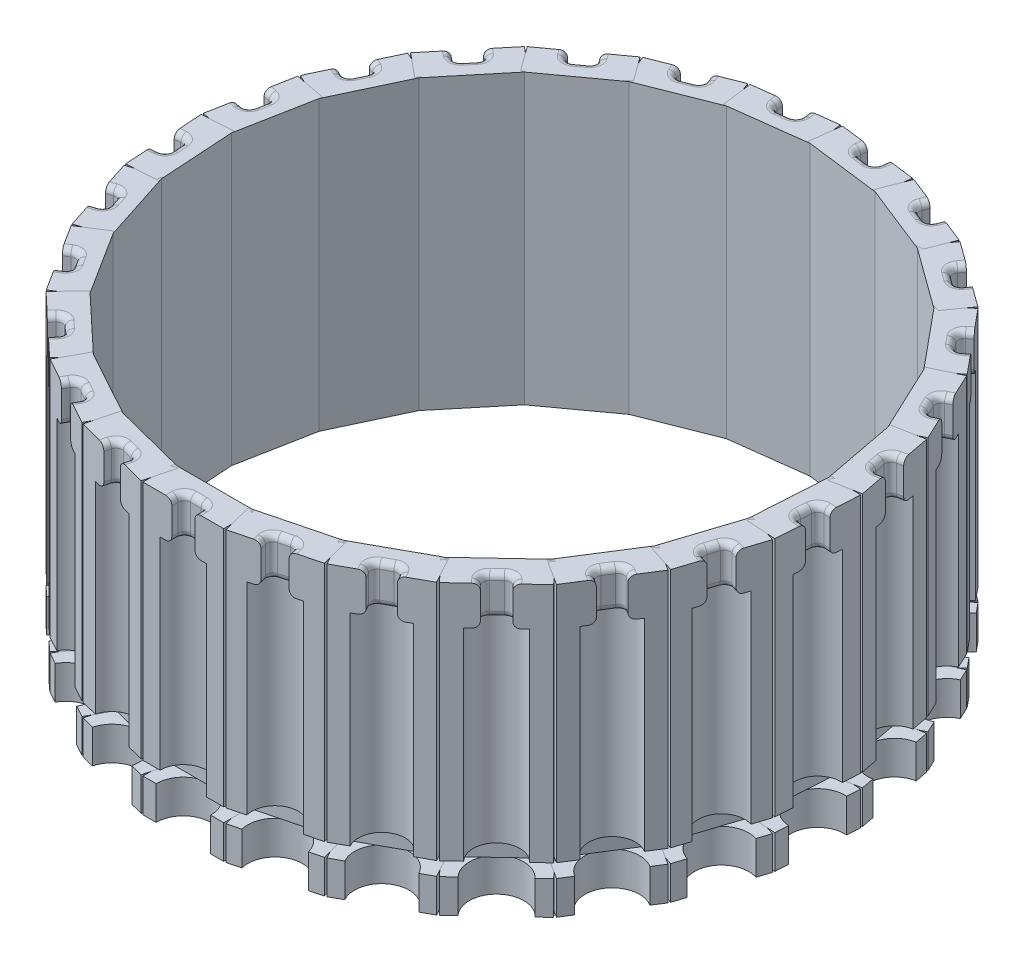
from build123d import *

# Parameters (mm, degrees)
SKETCH1_W           = 150
SKETCH1_H           = 300
BOSS_EXTRUDE1_DEPTH = 10
FLANGE_SLIT_W       = 26
FLANGE_SLIT_H       = 4.4
FLANGE_SLOT_DEPTH   = 8
SKETCH3_W           = 7.5
SKETCH3_H           = 65
SKETCH6_W           = 57.250839866
SKETCH6_H           = 300
CUT_EXTRUDE2_DEPTH  = 169.002976164
SKETCH7_W           = 8.778199967
SKETCH7_H           = 10.8
SKETCH8_W           = 7.4
SKETCH8_H           = 25.098320268
NEEDLE_SLOT_DEPTH   = 4
FILLET1_R           = 2
SKETCH11_W          = 274
SKETCH11_H          = 92.749160134
CUT_EXTRUDE3_DEPTH  = 169.002976164
CIRPATTERN2_COUNT   = 25


with BuildPart() as part:
    # Sketch1 → Boss-Extrude1 (new body)
    with BuildSketch(Plane(origin=(0, 0, 0), x_dir=(0, 1, 0), z_dir=(0, 0, 1))):
        Rectangle(SKETCH1_W, SKETCH1_H)
    extrude(amount=BOSS_EXTRUDE1_DEPTH)

    # flange slit → Flange Slot (cut)
    with BuildSketch(Plane.XY.offset(10)):
        with Locations((-137, -62)):
            Rectangle(FLANGE_SLIT_W, FLANGE_SLIT_H)
    extrude(amount=-FLANGE_SLOT_DEPTH, mode=Mode.SUBTRACT)

    # Sketch3 → Syringe Body Slot (revolve, cut)
    with BuildSketch(Plane.XY.offset(10)):
        with Locations((-140.75, -27.3)):
            Rectangle(SKETCH3_W, SKETCH3_H)
    revolve(axis=Axis((-137, 75, 10), (0, -1, 0)), mode=Mode.SUBTRACT)

    # Sketch6 → Cut-Extrude2 (cut, through all)
    with BuildSketch(Plane(origin=(0, 0, 10), x_dir=(0, -1, 0), z_dir=(0, 0, 1))):
        with Locations((-46.374580067, 0)):
            Rectangle(SKETCH6_W, SKETCH6_H)
    extrude(amount=-CUT_EXTRUDE2_DEPTH, mode=Mode.SUBTRACT)

    # Sketch7 → Plunger Slot (revolve, cut)
    with BuildSketch(Plane.XY.offset(10)):
        with Locations((-141.389099983, -69.6)):
            Rectangle(SKETCH7_W, SKETCH7_H)
    revolve(axis=Axis((-137, -64.2, 10), (0, -1, 0)), mode=Mode.SUBTRACT)

    # Sketch8 → Needle Slot (cut)
    with BuildSketch(Plane.XY.offset(10)):
        with Locations((-137, 5.2)):
            Rectangle(SKETCH8_W, SKETCH8_H)
    extrude(amount=-NEEDLE_SLOT_DEPTH, mode=Mode.SUBTRACT)

    # Fillet1
    fillet1_edges = [part.edges().sort_by_distance(p)[0] for p in [
        (-140.7, 17.749160134, 8),
        (-140.7, 5.2, 8),
        (-133.3, 17.749160134, 8),
        (-133.3, 5.2, 8),
        (-140.7, 11.474580067, 6),
        (-137, 17.749160134, 6),
        (-133.3, 11.474580067, 6),
        (-137, 5.2, 6),
    ]]
    fillet(fillet1_edges, radius=FILLET1_R)

    # Sketch11 → Cut-Extrude3 (cut, through all)
    with BuildSketch(Plane.XY.offset(10)):
        with Locations((13, -28.625419933)):
            Rectangle(SKETCH11_W, SKETCH11_H)
    extrude(amount=-CUT_EXTRUDE3_DEPTH, mode=Mode.SUBTRACT)


with BuildPart() as cirpattern2_1:
    # CirPattern2: pattern copy
    add(part.part.rotate(Axis((-137, -78.679881464, -95.483786158), (0, 1, 0)), 1 * 360 / CIRPATTERN2_COUNT))


with BuildPart() as cirpattern2_2:
    # CirPattern2: pattern copy
    add(part.part.rotate(Axis((-137, -78.679881464, -95.483786158), (0, 1, 0)), 2 * 360 / CIRPATTERN2_COUNT))


with BuildPart() as cirpattern2_3:
    # CirPattern2: pattern copy
    add(part.part.rotate(Axis((-137, -78.679881464, -95.483786158), (0, 1, 0)), 3 * 360 / CIRPATTERN2_COUNT))


with BuildPart() as cirpattern2_4:
    # CirPattern2: pattern copy
    add(part.part.rotate(Axis((-137, -78.679881464, -95.483786158), (0, 1, 0)), 4 * 360 / CIRPATTERN2_COUNT))


with BuildPart() as cirpattern2_5:
    # CirPattern2: pattern copy
    add(part.part.rotate(Axis((-137, -78.679881464, -95.483786158), (0, 1, 0)), 5 * 360 / CIRPATTERN2_COUNT))


with BuildPart() as cirpattern2_6:
    # CirPattern2: pattern copy
    add(part.part.rotate(Axis((-137, -78.679881464, -95.483786158), (0, 1, 0)), 6 * 360 / CIRPATTERN2_COUNT))


with BuildPart() as cirpattern2_7:
    # CirPattern2: pattern copy
    add(part.part.rotate(Axis((-137, -78.679881464, -95.483786158), (0, 1, 0)), 7 * 360 / CIRPATTERN2_COUNT))


with BuildPart() as cirpattern2_8:
    # CirPattern2: pattern copy
    add(part.part.rotate(Axis((-137, -78.679881464, -95.483786158), (0, 1, 0)), 8 * 360 / CIRPATTERN2_COUNT))


with BuildPart() as cirpattern2_9:
    # CirPattern2: pattern copy
    add(part.part.rotate(Axis((-137, -78.679881464, -95.483786158), (0, 1, 0)), 9 * 360 / CIRPATTERN2_COUNT))


with BuildPart() as cirpattern2_10:
    # CirPattern2: pattern copy
    add(part.part.rotate(Axis((-137, -78.679881464, -95.483786158), (0, 1, 0)), 10 * 360 / CIRPATTERN2_COUNT))


with BuildPart() as cirpattern2_11:
    # CirPattern2: pattern copy
    add(part.part.rotate(Axis((-137, -78.679881464, -95.483786158), (0, 1, 0)), 11 * 360 / CIRPATTERN2_COUNT))


with BuildPart() as cirpattern2_12:
    # CirPattern2: pattern copy
    add(part.part.rotate(Axis((-137, -78.679881464, -95.483786158), (0, 1, 0)), 12 * 360 / CIRPATTERN2_COUNT))


with BuildPart() as cirpattern2_13:
    # CirPattern2: pattern copy
    add(part.part.rotate(Axis((-137, -78.679881464, -95.483786158), (0, 1, 0)), 13 * 360 / CIRPATTERN2_COUNT))


with BuildPart() as cirpattern2_14:
    # CirPattern2: pattern copy
    add(part.part.rotate(Axis((-137, -78.679881464, -95.483786158), (0, 1, 0)), 14 * 360 / CIRPATTERN2_COUNT))


with BuildPart() as cirpattern2_15:
    # CirPattern2: pattern copy
    add(part.part.rotate(Axis((-137, -78.679881464, -95.483786158), (0, 1, 0)), 15 * 360 / CIRPATTERN2_COUNT))


with BuildPart() as cirpattern2_16:
    # CirPattern2: pattern copy
    add(part.part.rotate(Axis((-137, -78.679881464, -95.483786158), (0, 1, 0)), 16 * 360 / CIRPATTERN2_COUNT))


with BuildPart() as cirpattern2_17:
    # CirPattern2: pattern copy
    add(part.part.rotate(Axis((-137, -78.679881464, -95.483786158), (0, 1, 0)), 17 * 360 / CIRPATTERN2_COUNT))


with BuildPart() as cirpattern2_18:
    # CirPattern2: pattern copy
    add(part.part.rotate(Axis((-137, -78.679881464, -95.483786158), (0, 1, 0)), 18 * 360 / CIRPATTERN2_COUNT))


with BuildPart() as cirpattern2_19:
    # CirPattern2: pattern copy
    add(part.part.rotate(Axis((-137, -78.679881464, -95.483786158), (0, 1, 0)), 19 * 360 / CIRPATTERN2_COUNT))


with BuildPart() as cirpattern2_20:
    # CirPattern2: pattern copy
    add(part.part.rotate(Axis((-137, -78.679881464, -95.483786158), (0, 1, 0)), 20 * 360 / CIRPATTERN2_COUNT))


with BuildPart() as cirpattern2_21:
    # CirPattern2: pattern copy
    add(part.part.rotate(Axis((-137, -78.679881464, -95.483786158), (0, 1, 0)), 21 * 360 / CIRPATTERN2_COUNT))


with BuildPart() as cirpattern2_22:
    # CirPattern2: pattern copy
    add(part.part.rotate(Axis((-137, -78.679881464, -95.483786158), (0, 1, 0)), 22 * 360 / CIRPATTERN2_COUNT))


with BuildPart() as cirpattern2_23:
    # CirPattern2: pattern copy
    add(part.part.rotate(Axis((-137, -78.679881464, -95.483786158), (0, 1, 0)), 23 * 360 / CIRPATTERN2_COUNT))


with BuildPart() as cirpattern2_24:
    # CirPattern2: pattern copy
    add(part.part.rotate(Axis((-137, -78.679881464, -95.483786158), (0, 1, 0)), 24 * 360 / CIRPATTERN2_COUNT))


solid = Compound([part.part, cirpattern2_1.part, cirpattern2_2.part, cirpattern2_3.part, cirpattern2_4.part, cirpattern2_5.part, cirpattern2_6.part, cirpattern2_7.part, cirpattern2_8.part, cirpattern2_9.part, cirpattern2_10.part, cirpattern2_11.part, cirpattern2_12.part, cirpattern2_13.part, cirpattern2_14.part, cirpattern2_15.part, cirpattern2_16.part, cirpattern2_17.part, cirpattern2_18.part, cirpattern2_19.part, cirpattern2_20.part, cirpattern2_21.part, cirpattern2_22.part, cirpattern2_23.part, cirpattern2_24.part])
